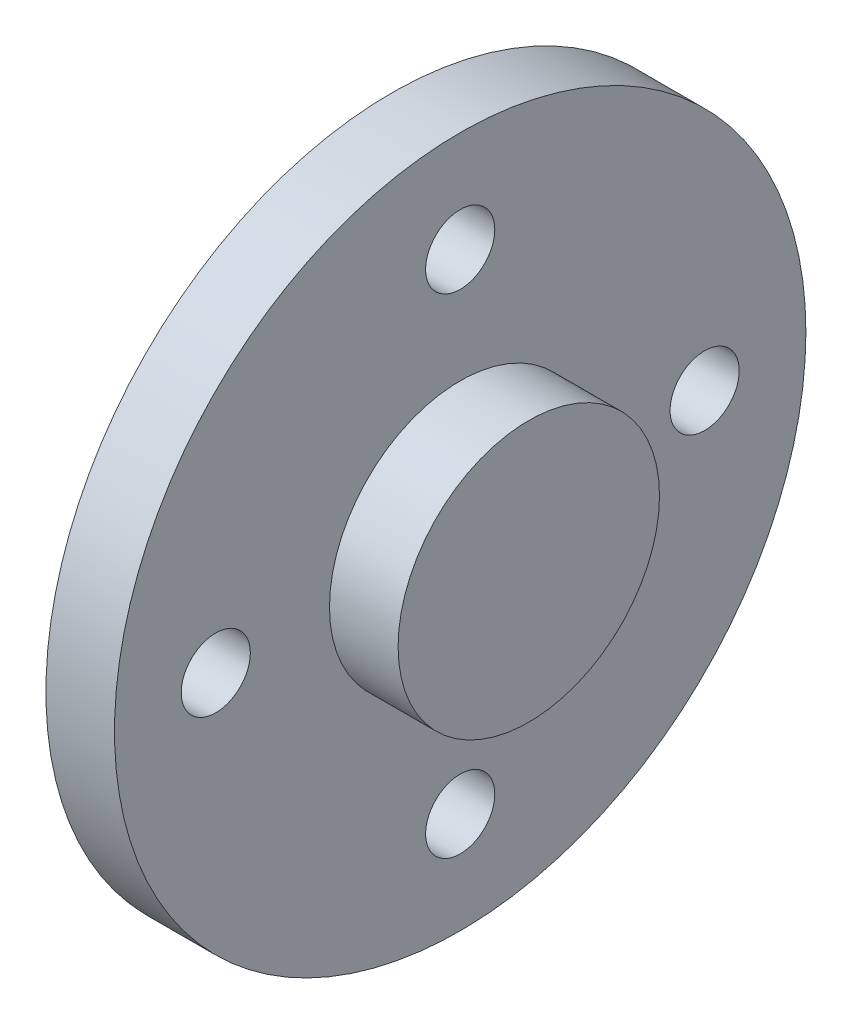
from build123d import *

# Parameters (mm, degrees)
SKETCH1_R           = 16
SKETCH1_R_2         = 1.6
BOSS_EXTRUDE1_DEPTH = 3.175
SKETCH2_R           = 6.05
BOSS_EXTRUDE2_DEPTH = 3.175


with BuildPart() as part:
    # Sketch1 → Boss-Extrude1 (new body)
    with BuildSketch(Plane(origin=(0, 0, 0), x_dir=(0, 0, -1), z_dir=(1, 0, 0))):
        Circle(SKETCH1_R)
        with Locations((0, 11.313708499)):
            Circle(SKETCH1_R_2, mode=Mode.SUBTRACT)
        with Locations((11.313708499, 0)):
            Circle(SKETCH1_R_2, mode=Mode.SUBTRACT)
        with Locations((0, -11.313708499)):
            Circle(SKETCH1_R_2, mode=Mode.SUBTRACT)
        with Locations((-11.313708499, 0)):
            Circle(SKETCH1_R_2, mode=Mode.SUBTRACT)
    extrude(amount=BOSS_EXTRUDE1_DEPTH)

    # Sketch2 → Boss-Extrude2 (add)
    with BuildSketch(Plane(origin=(3.175, 0, 0), x_dir=(0, 0, -1), z_dir=(1, 0, 0))):
        Circle(SKETCH2_R)
    extrude(amount=BOSS_EXTRUDE2_DEPTH)


solid = part.part
